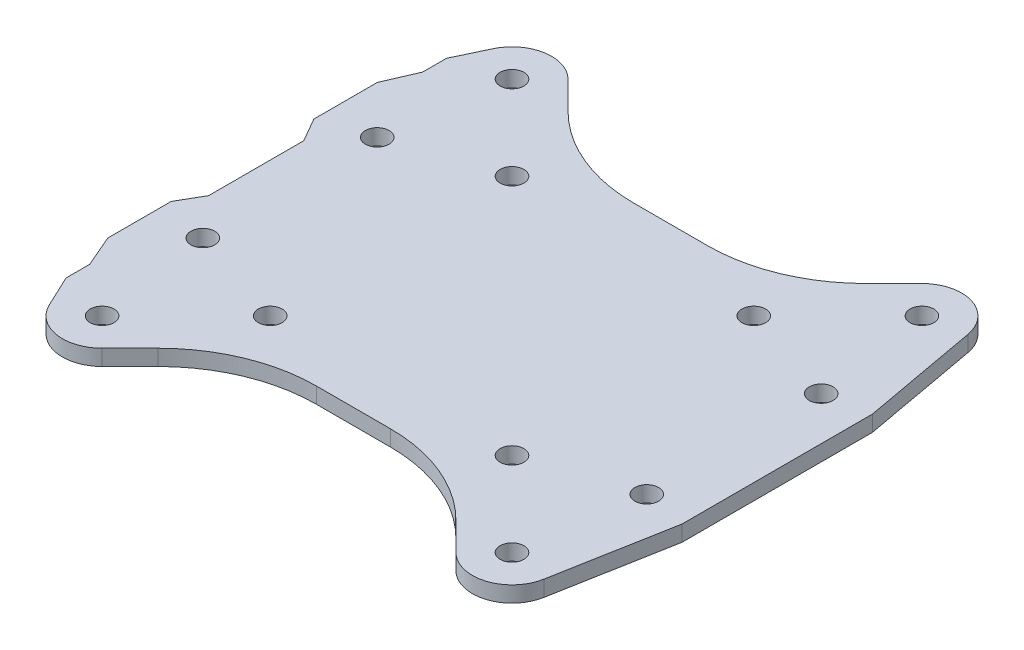
from build123d import *

# Parameters (mm, degrees)
SKETCH1_R           = 1.5
BOSS_EXTRUDE1_DEPTH = 2


with BuildPart() as part:
    # Sketch1 → Boss-Extrude1 (new body)
    # profile 1 of 5: a face of its own
    with BuildSketch(Plane(origin=(0, 0, 0), x_dir=(1, 0, 0), z_dir=(0, 1, 0))):
        with BuildLine():
            Line((-46.126205575, -14.349426059), (-42.591934327, -17.883697307))
            ThreePointArc((-42.591934327, -17.883697307), (-37.566674414, -19.121078278), (-34.137468144, -15.244882561))
            Line((-34.137468144, -15.244882561), (-31.447944327, -0.491561683))
            Line((-31.447944327, -0.491561683), (-31.447944327, 23.508438317))
            Line((-31.447944327, 23.508438317), (-34.137468144, 38.261759196))
            ThreePointArc((-34.137468144, 38.261759196), (-37.566674414, 42.137954912), (-42.591934327, 40.900573941))
            Line((-42.591934327, 40.900573941), (-46.126205575, 37.366302693))
            ThreePointArc((-46.126205575, 37.366302693), (-52.614672551, 33.030847667), (-60.268341199, 31.508438317))
            Line((-60.268341199, 31.508438317), (-69.55766308, 31.508438317))
            ThreePointArc((-69.55766308, 31.508438317), (-77.211331727, 33.030847667), (-83.699798704, 37.366302693))
            Line((-83.699798704, 37.366302693), (-87.234069951, 40.900573941))
            ThreePointArc((-87.234069951, 40.900573941), (-92.450628543, 42.073984291), (-95.744809303, 37.862363639))
            Line((-95.744809303, 37.862363639), (-97.179633644, 23.508438317))
            Line((-97.179633644, 23.508438317), (-97.179633644, -0.491561683))
            Line((-97.179633644, -0.491561683), (-95.744809303, -14.845487005))
            ThreePointArc((-95.744809303, -14.845487005), (-92.450628543, -19.057107657), (-87.234069951, -17.883697307))
            Line((-87.234069951, -17.883697307), (-83.699798704, -14.349426059))
            ThreePointArc((-83.699798704, -14.349426059), (-77.211331727, -10.013971033), (-69.55766308, -8.491561683))
            Line((-69.55766308, -8.491561683), (-60.268341199, -8.491561683))
            ThreePointArc((-60.268341199, -8.491561683), (-52.614672551, -10.013971033), (-46.126205575, -14.349426059))
        make_face()
        with Locations(Location((-39.056400421, -14.348163401, 0), (0, 0, 270))):
            Circle(SKETCH1_R, mode=Mode.SUBTRACT)
        with Locations(Location((-39.056400421, 37.365040035, 0), (0, 0, 270))):
            Circle(SKETCH1_R, mode=Mode.SUBTRACT)
        with Locations(Location((-90.769603857, -14.348163401, 0), (0, 0, 270))):
            Circle(SKETCH1_R, mode=Mode.SUBTRACT)
        with Locations(Location((-49.663002139, -3.741561683, 0), (0, 0, 270))):
            Circle(SKETCH1_R, mode=Mode.SUBTRACT)
        with Locations(Location((-80.163002139, -3.741561683, 0), (0, 0, 270))):
            Circle(SKETCH1_R, mode=Mode.SUBTRACT)
        with Locations(Location((-80.163002139, 26.758438317, 0), (0, 0, 270))):
            Circle(SKETCH1_R, mode=Mode.SUBTRACT)
        with Locations(Location((-49.663002139, 26.758438317, 0), (0, 0, 270))):
            Circle(SKETCH1_R, mode=Mode.SUBTRACT)
        with Locations(Location((-36.913002139, 22.508438317, 0), (0, 0, 270))):
            Circle(SKETCH1_R, mode=Mode.SUBTRACT)
        with Locations(Location((-36.913002139, 0.508438317, 0), (0, 0, 270))):
            Circle(SKETCH1_R, mode=Mode.SUBTRACT)
        with Locations(Location((-92.913002139, 0.508438317, 0), (0, 0, 270))):
            Circle(SKETCH1_R, mode=Mode.SUBTRACT)
        with Locations(Location((-92.913002139, 22.508438317, 0), (0, 0, 270))):
            Circle(SKETCH1_R, mode=Mode.SUBTRACT)
        with Locations(Location((-90.769603857, 37.365040035, 0), (0, 0, 270))):
            Circle(SKETCH1_R, mode=Mode.SUBTRACT)
    # profile 2 of 5: a face of its own
    with BuildSketch(Plane(origin=(0, 0, 0), x_dir=(1, 0, 0), z_dir=(0, 1, 0))):
        with BuildLine():
            Line((-95.744809303, -14.845487005), (-97.179633644, -0.491561683))
            Line((-97.179633644, -0.491561683), (-97.179633644, -9.491561683))
            Line((-97.179633644, -9.491561683), (-97.179633644, -12.491561683))
            Line((-97.179633644, -12.491561683), (-95.289163865, -16.486755774))
            ThreePointArc((-95.289163865, -16.486755774), (-95.5873921, -15.685667214), (-95.744809303, -14.845487005))
        make_face()
    # profile 3 of 5: a face of its own
    with BuildSketch(Plane(origin=(0, 0, 0), x_dir=(1, 0, 0), z_dir=(0, 1, 0))):
        with BuildLine():
            Line((-97.179633644, 23.508438317), (-95.744809303, 37.862363639))
            ThreePointArc((-95.744809303, 37.862363639), (-95.5873921, 38.702543848), (-95.289163865, 39.503632408))
            Line((-95.289163865, 39.503632408), (-97.179633644, 35.508438317))
            Line((-97.179633644, 35.508438317), (-97.179633644, 32.508438317))
            Line((-97.179633644, 32.508438317), (-97.179633644, 23.508438317))
        make_face()
    # profile 4 of 5: a face of its own
    with BuildSketch(Plane(origin=(0, 0, 0), x_dir=(1, 0, 0), z_dir=(0, 1, 0))):
        Polygon((-97.179633644, 17.508438317), (-97.179633644, 23.508438317), (-97.179633644, 32.508438317), (-98.909633644, 28.508438317), (-98.909633644, 20.508438317), align=None)
    # profile 5 of 5: a face of its own
    with BuildSketch(Plane(origin=(0, 0, 0), x_dir=(1, 0, 0), z_dir=(0, 1, 0))):
        Polygon((-97.179633644, -0.491561683), (-97.179633644, 5.508438317), (-98.909633644, 2.508438317), (-98.909633644, -5.491561683), (-97.179633644, -9.491561683), align=None)
    extrude(amount=BOSS_EXTRUDE1_DEPTH)


solid = part.part
